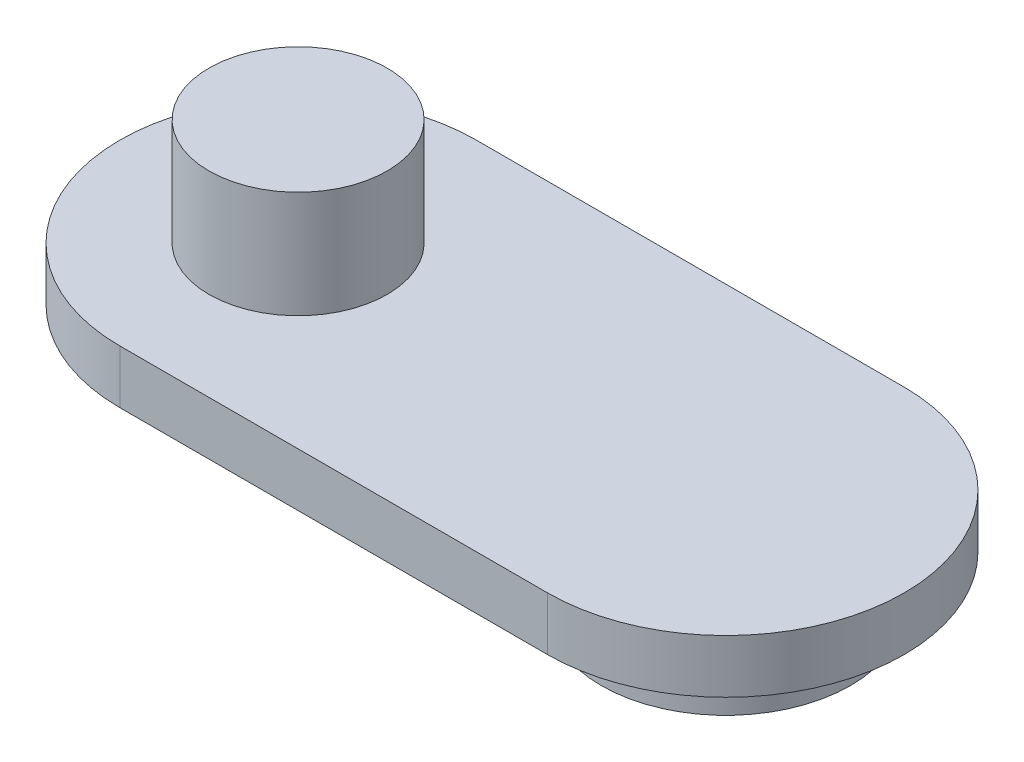
from build123d import *

# Parameters (mm, degrees)
EXTRUDE_1_DEPTH = 1.5
SKETCH_2_R      = 3.5
EXTRUDE_2_DEPTH = 1.5
SKETCH_3_R      = 2.5
EXTRUDE_3_DEPTH = 3


with BuildPart() as part:
    # 草图1 → 凸台-拉伸1 (new body)
    with BuildSketch(Plane(origin=(0, 0, 0), x_dir=(1, 0, 0), z_dir=(0, 1, 0))):
        with BuildLine():
            Line((0, 5), (12, 5))
            ThreePointArc((12, 5), (17, 0), (12, -5))
            Line((12, -5), (0, -5))
            ThreePointArc((0, -5), (-5, 0), (0, 5))
        make_face()
    extrude(amount=EXTRUDE_1_DEPTH)

    # 草图2 → 凸台-拉伸2 (add)
    with BuildSketch(Plane.XZ):
        with Locations(Location((12, 0, 0), (0, 0, 90))):
            Circle(SKETCH_2_R)
    extrude(amount=EXTRUDE_2_DEPTH)

    # 草图3 → 凸台-拉伸3 (add)
    with BuildSketch(Plane(origin=(0, 1.5, 0), x_dir=(1, 0, 0), z_dir=(0, 1, 0))):
        with Locations(Location((0, 0, 0), (0, 0, 270))):
            Circle(SKETCH_3_R)
    extrude(amount=EXTRUDE_3_DEPTH)


solid = part.part
